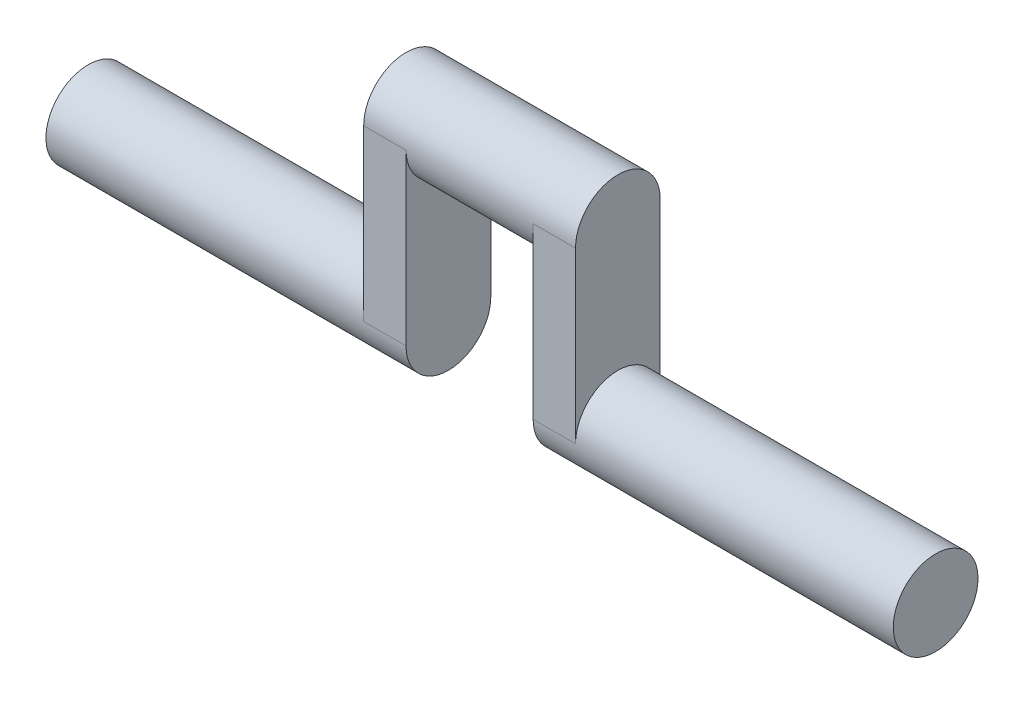
from build123d import *

# Parameters (mm, degrees)
SKETCH1_R           = 5
BOSS_EXTRUDE1_DEPTH = 42.5
BOSS_EXTRUDE2_START = -37.5
SKETCH1_3_R         = 5
BOSS_EXTRUDE2_DEPTH = 5
BOSS_EXTRUDE3_START = -37.5
SKETCH1_4_R         = 5
BOSS_EXTRUDE3_DEPTH = 25
BOSS_EXTRUDE4_START = -57.5
BOSS_EXTRUDE4_DEPTH = 5
BOSS_EXTRUDE5_START = -57.5
SKETCH1_6_R         = 5
BOSS_EXTRUDE5_DEPTH = 42.5


with BuildPart() as part:
    # Sketch1 → Boss-Extrude1 (new body)
    with BuildSketch(Plane(origin=(0, 0, 0), x_dir=(0, 0, -1), z_dir=(1, 0, 0))):
        Circle(SKETCH1_R)
    extrude(amount=-BOSS_EXTRUDE1_DEPTH)

    # Sketch1<3> → Boss-Extrude2 (add)
    with BuildSketch(Plane(origin=(0, 0, 0), x_dir=(0, 0, -1), z_dir=(1, 0, 0)).offset(BOSS_EXTRUDE2_START)):
        with BuildLine():
            ThreePointArc((5, 20), (0, 15), (-5, 20))
            Line((-5, 20), (-5, 0))
            ThreePointArc((-5, 0), (0, 5), (5, 0))
            Line((5, 0), (5, 20))
        make_face()
        with Locations((0, 20)):
            Circle(SKETCH1_3_R)
    extrude(amount=-BOSS_EXTRUDE2_DEPTH)

    # Sketch1<4> → Boss-Extrude3 (add)
    with BuildSketch(Plane(origin=(0, 0, 0), x_dir=(0, 0, -1), z_dir=(1, 0, 0)).offset(BOSS_EXTRUDE3_START)):
        with Locations((0, 20)):
            Circle(SKETCH1_4_R)
    extrude(amount=-BOSS_EXTRUDE3_DEPTH)

    # Sketch1<5> → Boss-Extrude4 (add)
    with BuildSketch(Plane(origin=(0, 0, 0), x_dir=(0, 0, -1), z_dir=(1, 0, 0)).offset(BOSS_EXTRUDE4_START)):
        with BuildLine():
            ThreePointArc((5, 20), (0, 15), (-5, 20))
            Line((-5, 20), (-5, 0))
            ThreePointArc((-5, 0), (0, 5), (5, 0))
            Line((5, 0), (5, 20))
        make_face()
    extrude(amount=-BOSS_EXTRUDE4_DEPTH)

    # Sketch1<6> → Boss-Extrude5 (add)
    with BuildSketch(Plane(origin=(0, 0, 0), x_dir=(0, 0, -1), z_dir=(1, 0, 0)).offset(BOSS_EXTRUDE5_START)):
        Circle(SKETCH1_6_R)
    extrude(amount=-BOSS_EXTRUDE5_DEPTH)


solid = part.part
